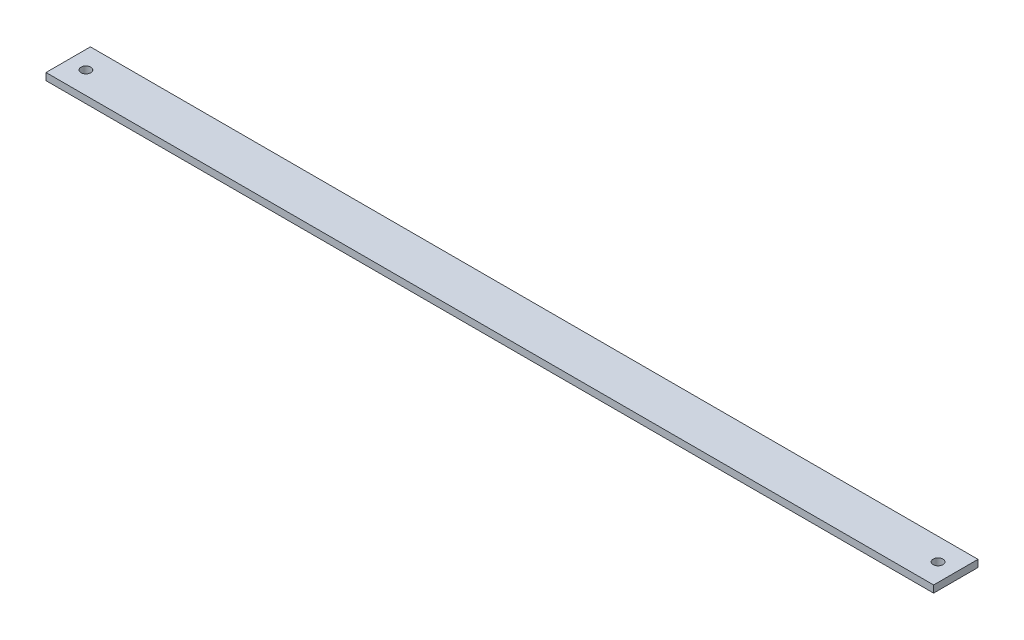
from build123d import *

# Parameters (mm, degrees)
SKETCH1_W           = 25
SKETCH1_H           = 4
BOSS_EXTRUDE1_DEPTH = 250
SKETCH2_R           = 2.75
CUT_EXTRUDE1_DEPTH  = 251.344262966


with BuildPart() as part:
    # Sketch1 → Boss-Extrude1 (new, symmetric)
    with BuildSketch(Plane(origin=(0, 0, 0), x_dir=(0, 0, -1), z_dir=(1, 0, 0))):
        Rectangle(SKETCH1_W, SKETCH1_H)
    extrude(amount=BOSS_EXTRUDE1_DEPTH, both=True)

    # Sketch2 → Cut-Extrude1 (cut, through all)
    with BuildSketch(Plane(origin=(0, 2, 0), x_dir=(1, 0, 0), z_dir=(0, 1, 0))):
        with Locations(Location((-240, 0, 0), (0, 0, 270))):
            Circle(SKETCH2_R)
        with Locations(Location((240, 0, 0), (0, 0, 90))):
            Circle(SKETCH2_R)
    extrude(amount=-CUT_EXTRUDE1_DEPTH, mode=Mode.SUBTRACT)


solid = part.part
